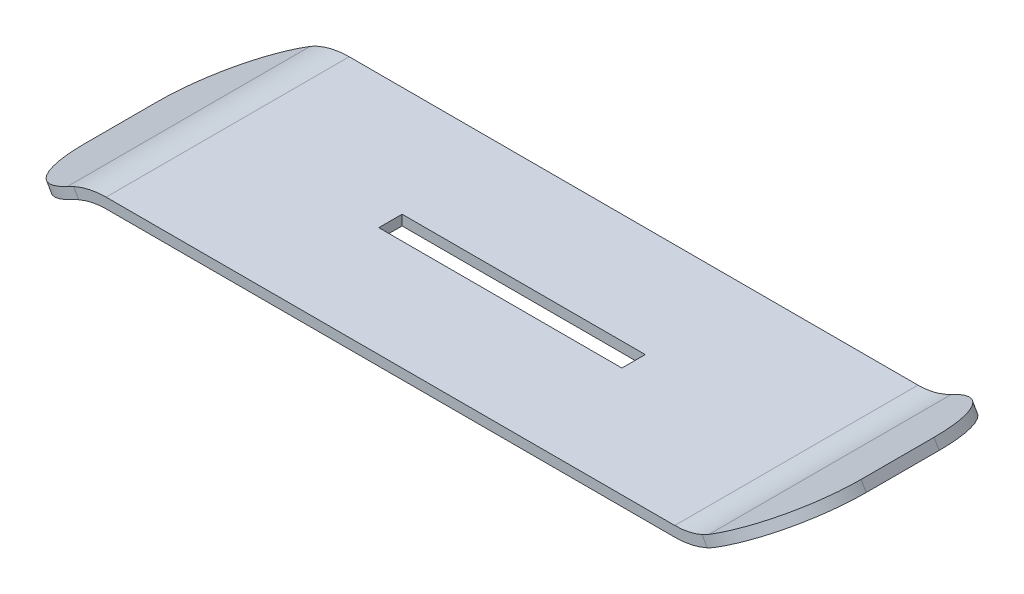
from build123d import *

# Parameters (mm, degrees)
EXTRUDE_THIN1_DEPTH = 12.7
FILLET1_R           = 8.89
SKETCH2_W           = 25.4
SKETCH2_H           = 2.4384
CUT_EXTRUDE1_DEPTH  = 44.175296885


with BuildPart() as part:
    # Sketch1 → Extrude-Thin1 (new, symmetric)
    with BuildSketch(Plane.XY):
        with BuildLine():
            Line((-40.282118102, -5.54193795), (-33.251527154, -1.482824374))
            ThreePointArc((-33.251527154, -1.482824374), (-31.542374199, -0.774870039), (-29.708227154, -0.5334))
            Line((-29.708227154, -0.5334), (29.708227154, -0.5334))
            ThreePointArc((29.708227154, -0.5334), (31.818482356, -0.255579632), (33.784927154, 0.558948473))
            Line((33.784927154, 0.558948473), (40.815518102, 4.61806205))
            Line((40.815518102, 4.61806205), (40.282118102, 5.54193795))
            Line((40.282118102, 5.54193795), (33.251527154, 1.482824374))
            ThreePointArc((33.251527154, 1.482824374), (31.542374199, 0.774870039), (29.708227154, 0.5334))
            Line((29.708227154, 0.5334), (-29.708227154, 0.5334))
            ThreePointArc((-29.708227154, 0.5334), (-31.818482356, 0.255579632), (-33.784927154, -0.558948473))
            Line((-33.784927154, -0.558948473), (-40.815518102, -4.61806205))
            Line((-40.815518102, -4.61806205), (-40.282118102, -5.54193795))
        make_face()
    extrude(amount=EXTRUDE_THIN1_DEPTH, both=True)

    # Fillet1
    fillet1_edges = [part.edges().sort_by_distance(p)[0] for p in [
        (40.548818102, 5.08, -12.7),
        (40.548818102, 5.08, 12.7),
        (-40.548818102, -5.08, -12.7),
        (-40.548818102, -5.08, 12.7),
    ]]
    fillet(fillet1_edges, radius=FILLET1_R)

    # Sketch2 → Cut-Extrude1 (cut, through all)
    with BuildSketch(Plane(origin=(0, 0.5334, 0), x_dir=(1, 0, 0), z_dir=(0, 1, 0))):
        Rectangle(SKETCH2_W, SKETCH2_H)
    extrude(amount=-CUT_EXTRUDE1_DEPTH, mode=Mode.SUBTRACT)


solid = part.part
